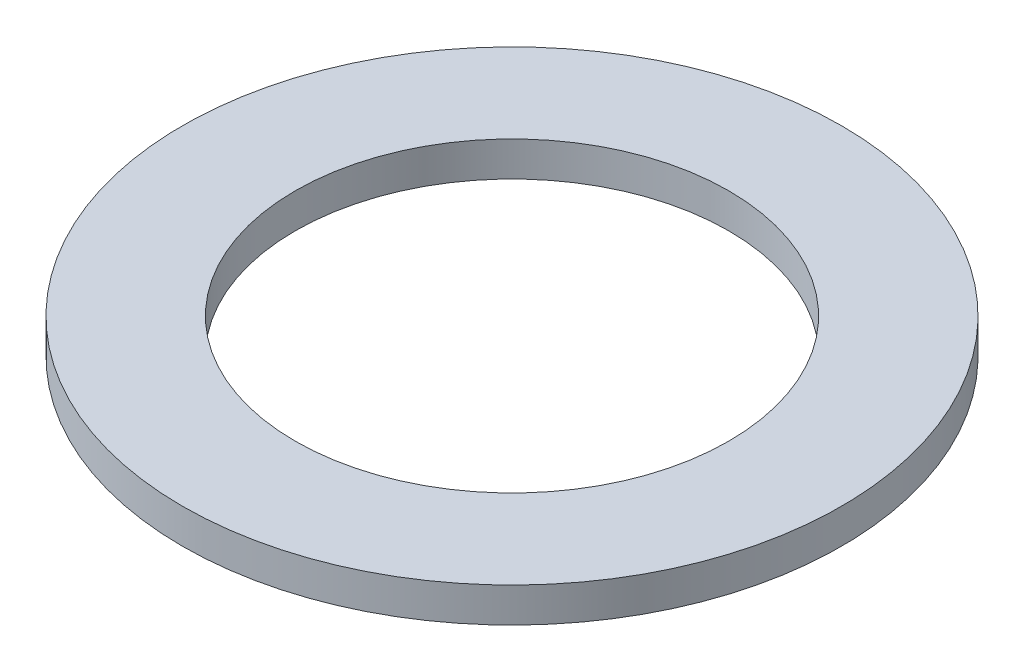
from build123d import *

# Parameters (mm, degrees)
SKETCH1_R           = 19
SKETCH1_R_2         = 12.5
BOSS_EXTRUDE1_DEPTH = 2


with BuildPart() as part:
    # Sketch1 → Boss-Extrude1 (new body)
    with BuildSketch(Plane(origin=(0, 0, 0), x_dir=(1, 0, 0), z_dir=(0, 1, 0))):
        with Locations(Location((0, 0, 0), (0, 0, 270))):
            Circle(SKETCH1_R)
        with Locations(Location((0, 0, 0), (0, 0, 270))):
            Circle(SKETCH1_R_2, mode=Mode.SUBTRACT)
    extrude(amount=BOSS_EXTRUDE1_DEPTH)


solid = part.part
